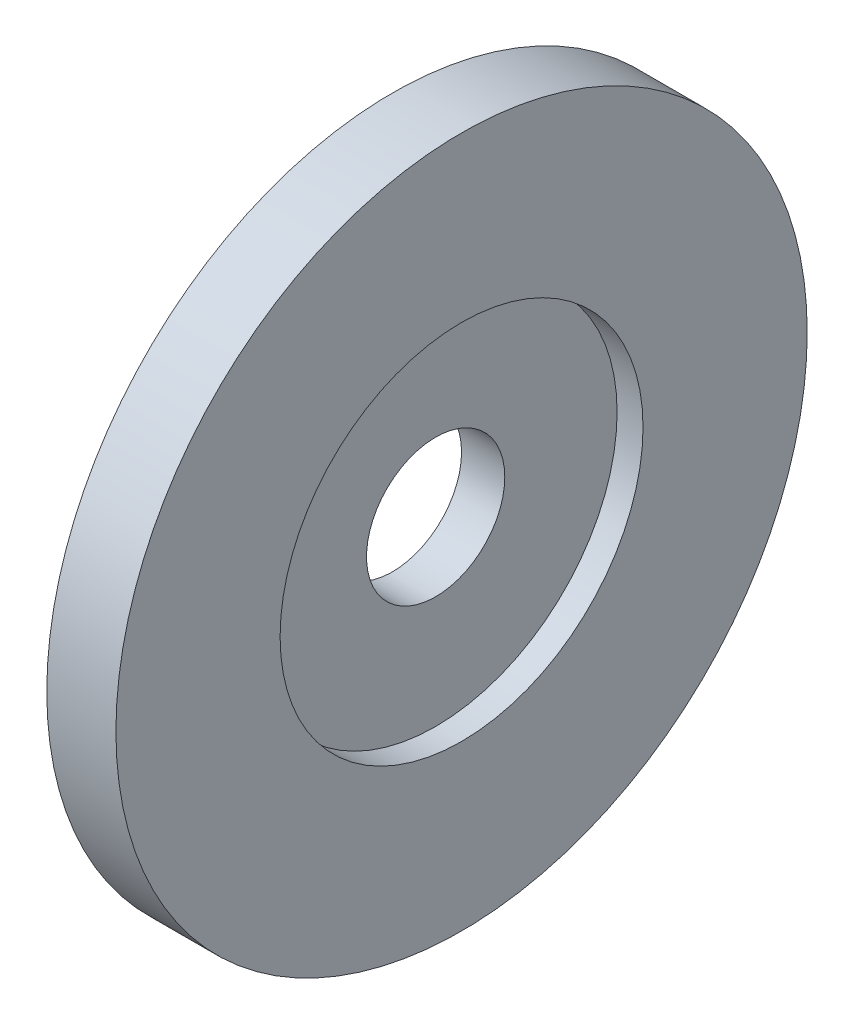
from build123d import *

# Parameters (mm, degrees)
CROQUIS1_R              = 20
CROQUIS1_R_2            = 4
SALIENTE_EXTRUIR1_DEPTH = 4
CROQUIS2_R              = 10.5
CORTAR_EXTRUIR1_DEPTH   = 1.5


with BuildPart() as part:
    # Croquis1 → Saliente-Extruir1 (new body)
    with BuildSketch(Plane(origin=(0, 0, 0), x_dir=(0, 0, -1), z_dir=(1, 0, 0))):
        with Locations((-70, 0)):
            Circle(CROQUIS1_R)
        with Locations((-70, 0)):
            Circle(CROQUIS1_R_2, mode=Mode.SUBTRACT)
    extrude(amount=SALIENTE_EXTRUIR1_DEPTH)

    # Croquis2 → Cortar-Extruir1 (cut)
    with BuildSketch(Plane(origin=(4, 0, 0), x_dir=(0, 0, -1), z_dir=(1, 0, 0))):
        with Locations((-70, 0)):
            Circle(CROQUIS2_R)
    extrude(amount=-CORTAR_EXTRUIR1_DEPTH, mode=Mode.SUBTRACT)


solid = part.part
